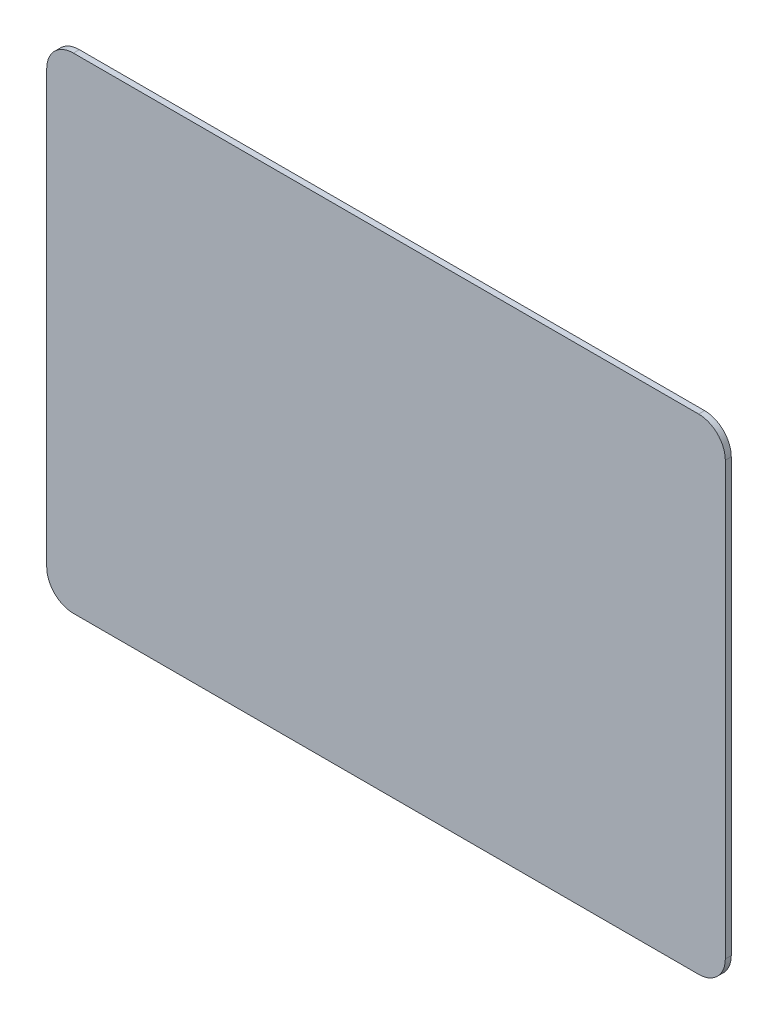
from build123d import *

# Parameters (mm, degrees)
BOSS_EXTRUDE1_DEPTH = 3.175


with BuildPart() as part:
    # Sketch1 → Boss-Extrude1 (new body)
    with BuildSketch(Plane.XY):
        with BuildLine():
            Line((-41.405944168, 47.456216238), (292.096055832, 47.456216238))
            ThreePointArc((292.096055832, 47.456216238), (302.153942688, 43.290103094), (306.320055832, 33.232216238))
            Line((306.320055832, 33.232216238), (306.320055832, -197.145783762))
            ThreePointArc((306.320055832, -197.145783762), (302.153942688, -207.203670617), (292.096055832, -211.369783762))
            Line((292.096055832, -211.369783762), (-41.405944168, -211.369783762))
            ThreePointArc((-41.405944168, -211.369783762), (-51.463831024, -207.203670617), (-55.629944168, -197.145783762))
            Line((-55.629944168, -197.145783762), (-55.629944168, 33.232216238))
            ThreePointArc((-55.629944168, 33.232216238), (-51.463831024, 43.290103094), (-41.405944168, 47.456216238))
        make_face()
    extrude(amount=-BOSS_EXTRUDE1_DEPTH)


solid = part.part
